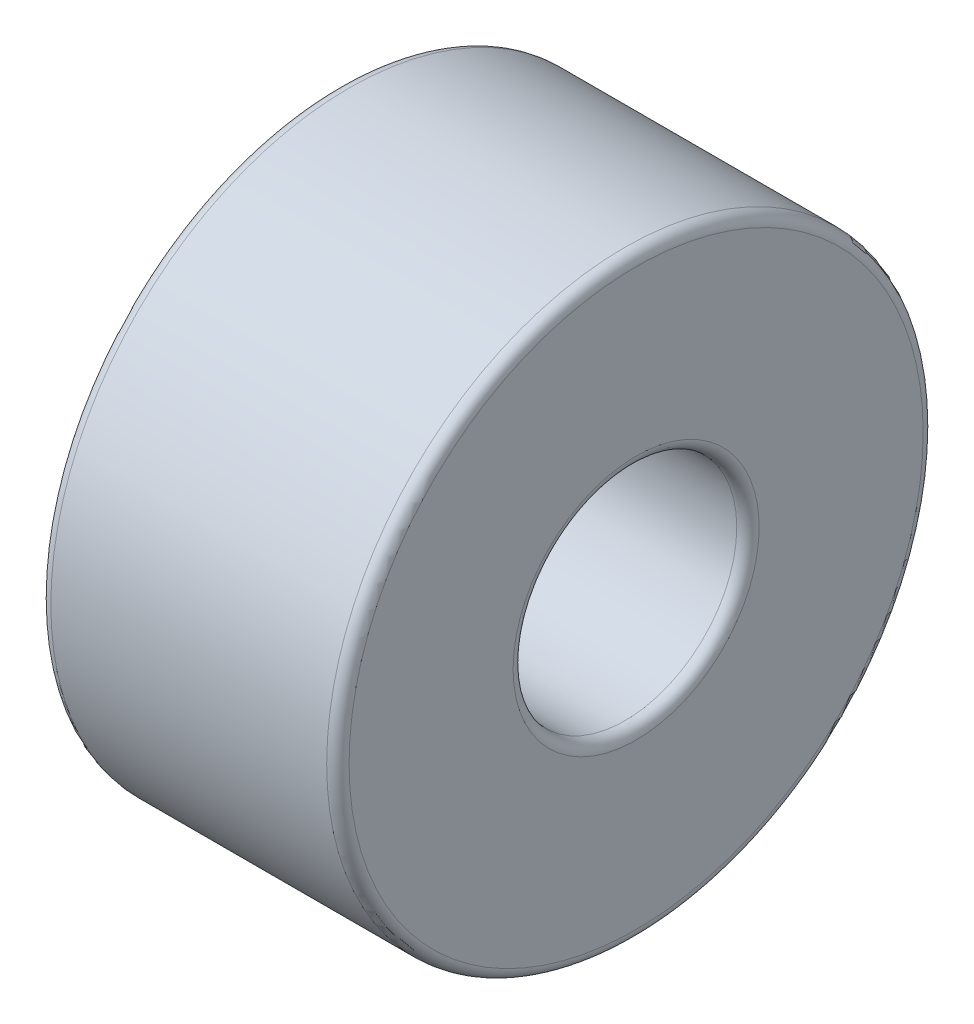
from build123d import *


with BuildPart() as part:
    # Sketch1 → Revolve1 (revolve)
    with BuildSketch(Plane(origin=(0, 0, 0), x_dir=(-1, 0, 0), z_dir=(0, 0, -1)), mode=Mode.PRIVATE) as revolve1_sk:
        with BuildLine():
            Line((-3.85, 1.5), (-0.15, 1.5))
            ThreePointArc((-0.15, 1.5), (-0.043933983, 1.543933983), (0, 1.65))
            Line((0, 1.65), (0, 3.85))
            ThreePointArc((0, 3.85), (-0.043933983, 3.956066017), (-0.15, 4))
            Line((-0.15, 4), (-3.85, 4))
            ThreePointArc((-3.85, 4), (-3.956066017, 3.956066017), (-4, 3.85))
            Line((-4, 3.85), (-4, 1.65))
            ThreePointArc((-4, 1.65), (-3.956066017, 1.543933983), (-3.85, 1.5))
        make_face()
        Polygon((-0.75, 2.8175), (-0.75, 2.6825), (-1.9325, 2.6825), (-1.9325, 2.333333333), (-2.0675, 2.333333333), (-2.0675, 2.6825), (-3.25, 2.6825), (-3.25, 2.8175), (-2.0675, 2.8175), (-2.0675, 3.166666667), (-1.9325, 3.166666667), (-1.9325, 2.8175), align=None, mode=Mode.SUBTRACT)
    revolve(revolve1_sk.sketch.rotate(Axis((4, 0, 0), (-1, 0, 0)), 270), axis=Axis((4, 0, 0), (-1, 0, 0)))


solid = part.part
